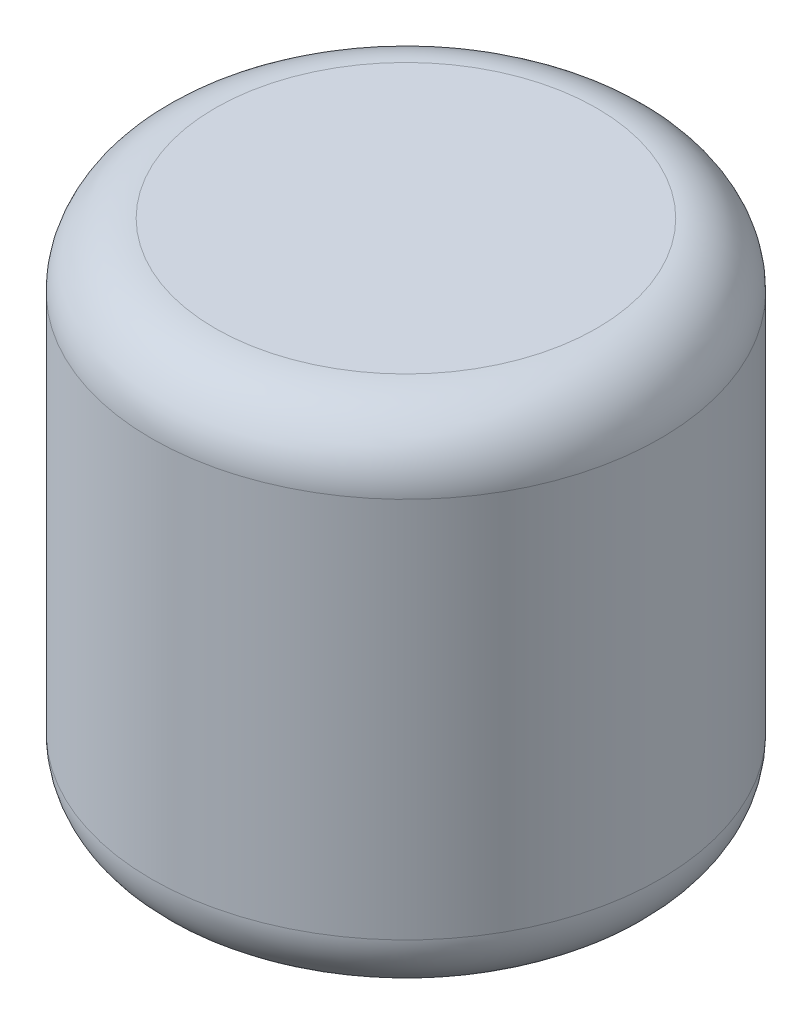
from build123d import *

# Parameters (mm, degrees)
SKETCH_1_R      = 2
EXTRUDE_1_DEPTH = 2
FILLET_1_R      = 0.5


with BuildPart() as part:
    # Эскиз1 → Бобышка-Вытянуть1 (new, symmetric)
    with BuildSketch(Plane(origin=(0, 0, 0), x_dir=(1, 0, 0), z_dir=(0, 1, 0))):
        with Locations(Location((0, 0, 0), (0, 0, 270))):
            Circle(SKETCH_1_R)
    extrude(amount=EXTRUDE_1_DEPTH, both=True)

    # Скругление1
    fillet_1_edges = [part.edges().sort_by_distance(p)[0] for p in [
        (0, -2, -2),
        (0, 2, -2),
    ]]
    fillet(fillet_1_edges, radius=FILLET_1_R)


solid = part.part
